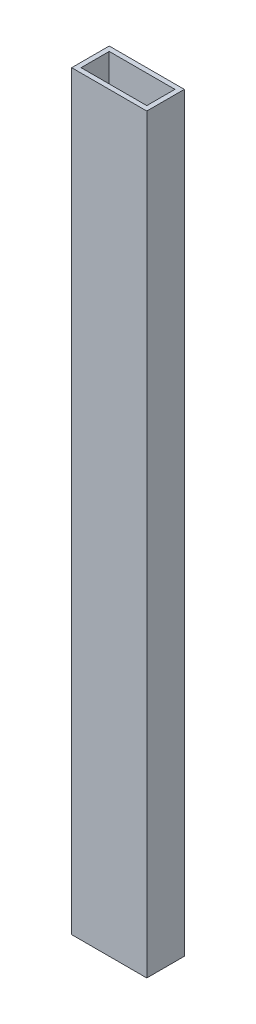
from build123d import *

# Parameters (mm, degrees)
SKETCH1_W           = 50.8
SKETCH1_H           = 25.4
SKETCH1_W_2         = 44.45
SKETCH1_H_2         = 19.05
BOSS_EXTRUDE1_DEPTH = 508


with BuildPart() as part:
    # Sketch1 → Boss-Extrude1 (new body)
    with BuildSketch(Plane(origin=(0, 0, 0), x_dir=(1, 0, 0), z_dir=(0, 1, 0))):
        Rectangle(SKETCH1_W, SKETCH1_H)
        Rectangle(SKETCH1_W_2, SKETCH1_H_2, mode=Mode.SUBTRACT)
    extrude(amount=BOSS_EXTRUDE1_DEPTH)


solid = part.part
